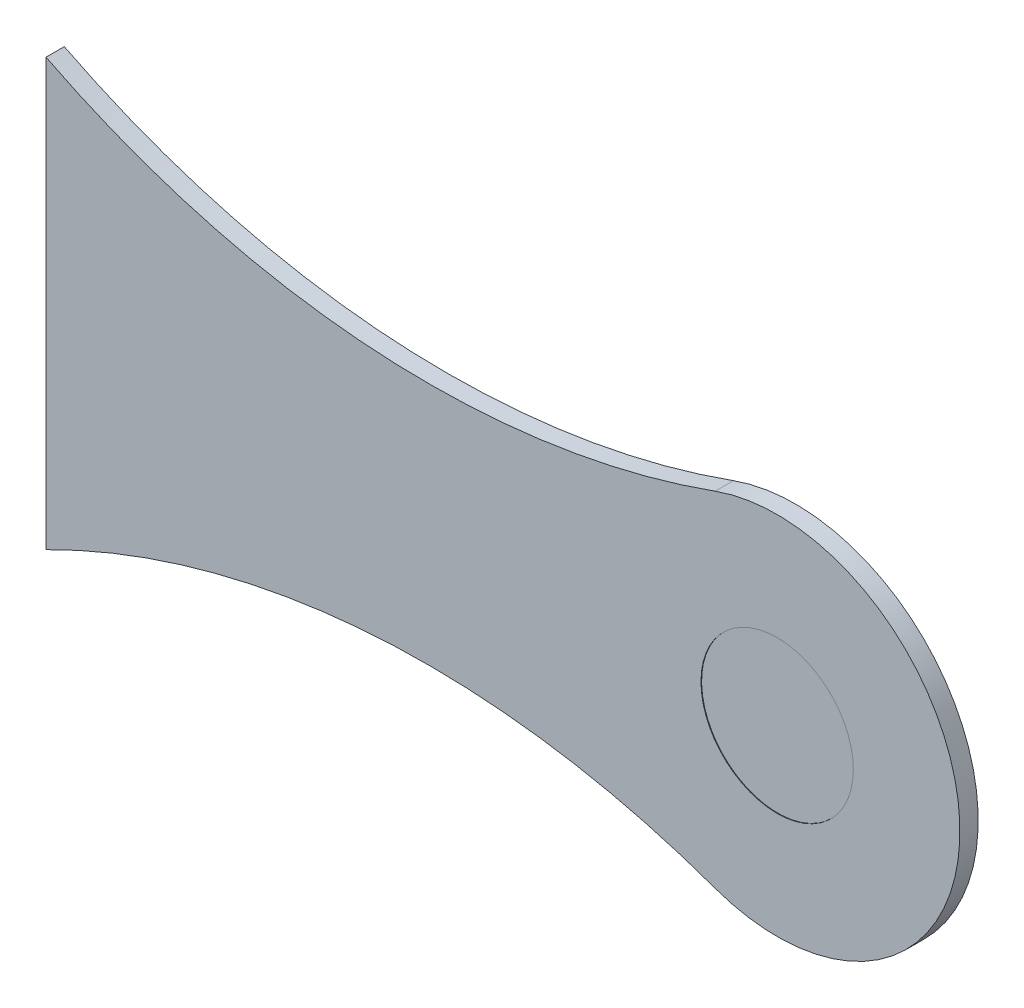
from build123d import *

# Parameters (mm, degrees)
SKETCH1_R                = 12.5
BOSS_EXTRUDE1_DEPTH      = 1.5
BOSS_EXTRUDE2_DEPTH      = 1.4
BOSS_EXTRUDE2_DEPTH_BACK = 1.4
SKETCH1_3_R              = 12.5
BODY_MOVE_COPY1_ANGLE    = 90


with BuildPart() as part:
    # Sketch1 → Boss-Extrude1 (new, symmetric)
    with BuildSketch(Plane(origin=(0, 0, 0), x_dir=(1, 0, 0), z_dir=(0, 1, 0))):
        with BuildLine():
            Line((-120, 35), (-120, -35))
            ThreePointArc((-120, -35), (-65.786340219, -20.263519795), (-10.172182489, -28.222804669))
            ThreePointArc((-10.172182489, -28.222804669), (30, 0), (-10.172182489, 28.222804669))
            ThreePointArc((-10.172182489, 28.222804669), (-65.786340219, 20.263519795), (-120, 35))
        make_face()
        with Locations(Location((0, 0, 0), (0, 0, 270))):
            Circle(SKETCH1_R, mode=Mode.SUBTRACT)
    extrude(amount=BOSS_EXTRUDE1_DEPTH, both=True)

    # Sketch1<3> → Boss-Extrude2 (add, two sides: drawn at the far end of the back side and taken through both)
    with BuildSketch(Plane(origin=(0, 0, 0), x_dir=(1, 0, 0), z_dir=(0, 1, 0)).offset(-BOSS_EXTRUDE2_DEPTH_BACK)):
        with Locations(Location((0, 0, 0), (0, 0, 90))):
            Circle(SKETCH1_3_R)
    extrude(amount=BOSS_EXTRUDE2_DEPTH + BOSS_EXTRUDE2_DEPTH_BACK)


with BuildPart() as part_1:
    # Body-Move/Copy1: moved
    add(part.part.rotate(Axis((0, 0, 0), (1, 0, 0)), BODY_MOVE_COPY1_ANGLE))


solid = part_1.part
